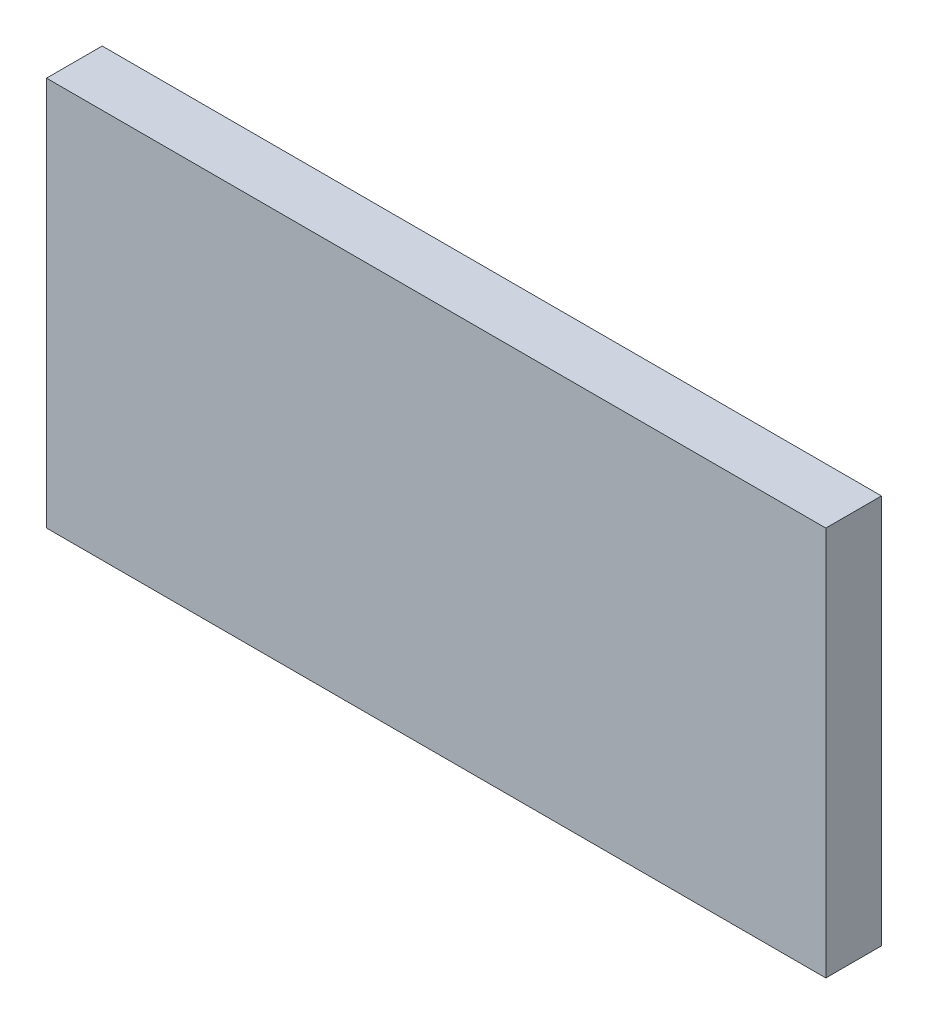
from build123d import *

# Parameters (mm, degrees)
SKETCH1_W           = 88.9
SKETCH1_H           = 44.45
BOSS_EXTRUDE1_DEPTH = 6.35


with BuildPart() as part:
    # Sketch1 → Boss-Extrude1 (new body)
    with BuildSketch(Plane.XY):
        with Locations((-44.45, 22.225)):
            Rectangle(SKETCH1_W, SKETCH1_H)
    extrude(amount=BOSS_EXTRUDE1_DEPTH)


solid = part.part
